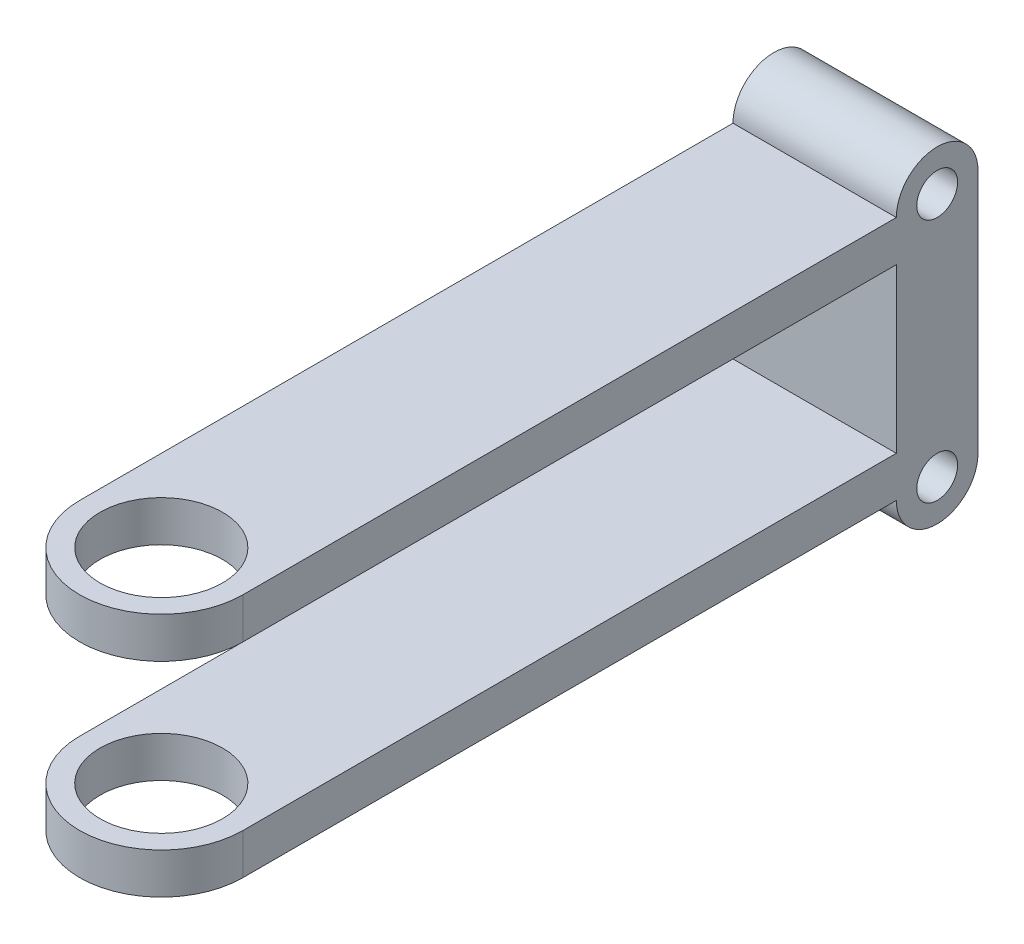
from build123d import *

# Parameters (mm, degrees)
SKETCH_1_R           = 15
EXTRUDE_1_DEPTH      = 60
SKETCH_2_W           = 40
SKETCH_2_H           = 40
CUT_EXTRUDE_1_DEPTH  = 190
EXTRUDE_2_DEPTH      = 50
EXTRUDE_2_DEPTH_BACK = 10
SKETCH_4_R           = 10
EXTRUDE_3_DEPTH      = 40
SKETCH_5_R           = 5
CUT_EXTRUDE_3_DEPTH  = 40


with BuildPart() as part:
    # 草图1 → 凸台-拉伸1 (new body)
    with BuildSketch(Plane(origin=(0, 0, 0), x_dir=(1, 0, 0), z_dir=(0, 1, 0))):
        with BuildLine():
            Line((20, 0), (20, 170))
            Line((20, 170), (-20, 170))
            Line((-20, 170), (-20, 0))
            ThreePointArc((-20, 0), (0, -20), (20, 0))
        make_face()
        with Locations(Location((0, 0, 0), (0, 0, 270))):
            Circle(SKETCH_1_R, mode=Mode.SUBTRACT)
    extrude(amount=EXTRUDE_1_DEPTH)

    # 草图2 → 切除-拉伸1 (cut)
    with BuildSketch(Plane(origin=(0, 0, -170), x_dir=(-1, 0, 0), z_dir=(0, 0, -1))):
        with Locations((0, 30)):
            Rectangle(SKETCH_2_W, SKETCH_2_H)
    extrude(amount=-CUT_EXTRUDE_1_DEPTH, mode=Mode.SUBTRACT)


with BuildPart() as cut_extrude_1_piece_1:
    # of the separate pieces the step leaves, piece 1, a body of its own (cut_extrude_1_pieces)
    add(part.part.solids().sort_by_distance((20, 50, -170))[0])



with BuildPart() as cut_extrude_1_piece_2:
    # of the separate pieces the step leaves, piece 2, a body of its own (cut_extrude_1_pieces)
    add(part.part.solids().sort_by_distance((20, 0, 0))[0])


with BuildPart() as cut_extrude_1_piece_1_1:
    add(cut_extrude_1_piece_1.part)

    add(cut_extrude_1_piece_2.part)  # 凸台-拉伸2 merges 切除-拉伸1 piece 2
    # 草图3 → 凸台-拉伸2 (add, two sides: drawn at the far end of the back side and taken through both)
    with BuildSketch(Plane(origin=(0, 10, 0), x_dir=(1, 0, 0), z_dir=(0, 1, 0)).offset(-EXTRUDE_2_DEPTH_BACK)):
        Polygon((20, 170), (20, 160), (-20, 160), (-20, 170), (-20, 180), (20, 180), align=None)
    extrude(amount=EXTRUDE_2_DEPTH + EXTRUDE_2_DEPTH_BACK)

    # 草图4 → 凸台-拉伸3 (add)
    with BuildSketch(Plane.ZY.offset(20)):
        with Locations((-170, 0)):
            Circle(SKETCH_4_R)
        with Locations((-170, 60)):
            Circle(SKETCH_4_R)
    extrude(amount=-EXTRUDE_3_DEPTH)

    # 草图5 → 切除-拉伸3 (cut)
    with BuildSketch(Plane.ZY.offset(20)):
        with Locations((-170, 0)):
            Circle(SKETCH_5_R)
        with Locations((-170, 60)):
            Circle(SKETCH_5_R)
    extrude(amount=-CUT_EXTRUDE_3_DEPTH, mode=Mode.SUBTRACT)


solid = cut_extrude_1_piece_1_1.part
